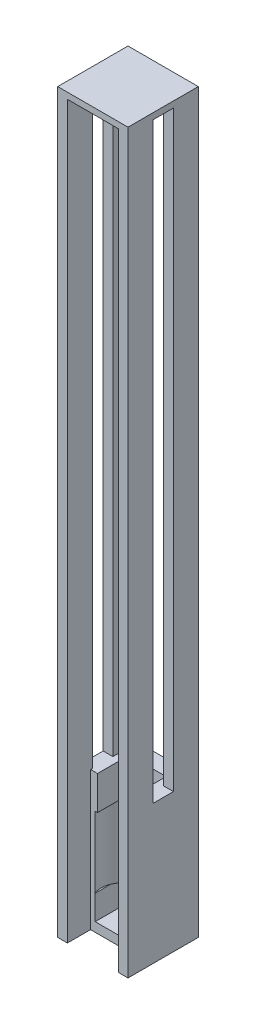
from build123d import *

# Parameters (mm, degrees)
SKETCH1_W           = 22.794602658
SKETCH1_H           = 22.794602658
BOSS_EXTRUDE1_DEPTH = 22.5
SKETCH2_R           = 7.25
CUT_EXTRUDE1_DEPTH  = 11.5
SKETCH4_W           = 16.511455896
SKETCH4_H           = 45
CUT_EXTRUDE2_DEPTH  = 7.5
SKETCH6_W           = 3.141573381
SKETCH6_H           = 8.057746469
BOSS_EXTRUDE2_DEPTH = 192
SKETCH8_W           = 22.794602658
SKETCH8_H           = 22.794602658
BOSS_EXTRUDE3_DEPTH = 2
SKETCH10_W          = 12
SKETCH10_H          = 12.75
CUT_EXTRUDE4_DEPTH  = 11
SKETCH11_W          = 13.5
SKETCH11_H          = 13.5
CUT_EXTRUDE5_DEPTH  = 8


with BuildPart() as part:
    # Sketch1 → Boss-Extrude1 (new, symmetric)
    with BuildSketch(Plane(origin=(0, 0, 0), x_dir=(1, 0, 0), z_dir=(0, 1, 0))):
        Rectangle(SKETCH1_W, SKETCH1_H)
    extrude(amount=BOSS_EXTRUDE1_DEPTH, both=True)

    # Sketch2 → Cut-Extrude1 (cut, symmetric)
    with BuildSketch(Plane(origin=(0, 0, 0), x_dir=(1, 0, 0), z_dir=(0, 1, 0))):
        with Locations(Location((0, -1.5, 0), (0, 0, 270))):
            Circle(SKETCH2_R)
    extrude(amount=CUT_EXTRUDE1_DEPTH, both=True, mode=Mode.SUBTRACT)

    # Sketch4 → Cut-Extrude2 (cut, symmetric)
    with BuildSketch(Plane.XY.offset(11.397301329)):
        Rectangle(SKETCH4_W, SKETCH4_H)
    extrude(amount=CUT_EXTRUDE2_DEPTH, both=True, mode=Mode.SUBTRACT)

    # Sketch6 → Boss-Extrude2 (add)
    with BuildSketch(Plane(origin=(0, 22.5, 0), x_dir=(1, 0, 0), z_dir=(0, 1, 0))):
        with Locations((-9.826514639, 7.368428095)):
            Rectangle(SKETCH6_W, SKETCH6_H)
        with Locations((9.826514639, 7.368428095)):
            Rectangle(SKETCH6_W, SKETCH6_H)
        with Locations((-9.826514639, -7.368428095)):
            Rectangle(SKETCH6_W, SKETCH6_H)
        with Locations((9.826514639, -7.368428095)):
            Rectangle(SKETCH6_W, SKETCH6_H)
    extrude(amount=BOSS_EXTRUDE2_DEPTH)

    # Sketch8 → Boss-Extrude3 (add)
    with BuildSketch(Plane(origin=(0, 214.5, 0), x_dir=(1, 0, 0), z_dir=(0, 1, 0))):
        Rectangle(SKETCH8_W, SKETCH8_H)
    extrude(amount=BOSS_EXTRUDE3_DEPTH)

    # Sketch10 → Cut-Extrude4 (cut)
    with BuildSketch(Plane.XZ.offset(-11.5)):
        Rectangle(SKETCH10_W, SKETCH10_H)
    extrude(amount=-CUT_EXTRUDE4_DEPTH, mode=Mode.SUBTRACT)

    # Sketch11 → Cut-Extrude5 (cut)
    with BuildSketch(Plane(origin=(0, -11.5, 0), x_dir=(1, 0, 0), z_dir=(0, 1, 0))):
        with Locations((0, -1.5)):
            Rectangle(SKETCH11_W, SKETCH11_H)
    extrude(amount=-CUT_EXTRUDE5_DEPTH, mode=Mode.SUBTRACT)


solid = part.part
